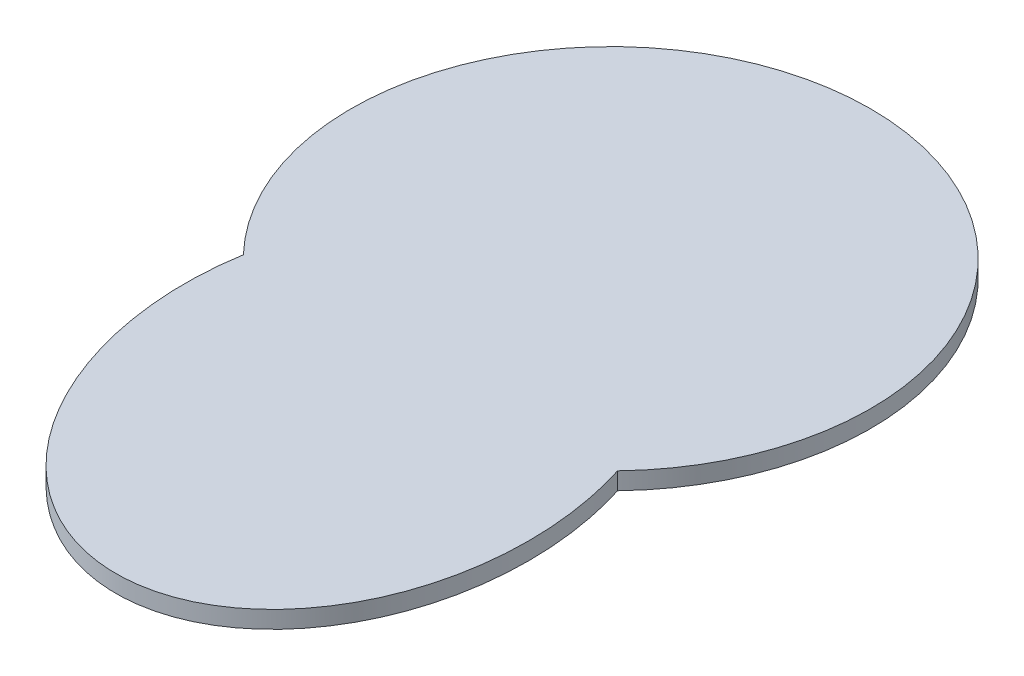
from build123d import *

# Parameters (mm, degrees)
BOSS_EXTRUDE1_DEPTH = 4


with BuildPart() as part:
    # Sketch1 → Boss-Extrude1 (new body)
    with BuildSketch(Plane(origin=(0, 0, 0), x_dir=(1, 0, 0), z_dir=(0, 1, 0))):
        with BuildLine():
            ThreePointArc((41.934392463, 18.394596154), (-1.366877727, 120.240673842), (-44.668147916, 18.394596154))
            add(Edge.make_bspline(
                [(-44.668147916, 18.394596154), (-57.852745086, -60.252747888), (4.477300744, -60.252747888), (66.807346575, -60.252747888), (41.934392463, 18.394596154)],
                knots=[4.276241532, 4.276241532, 4.276241532, 6.157281417, 6.157281417, 8.038321303, 8.038321303, 8.038321303], degree=2, weights=[1, 0.589368061, 1, 0.589368061, 1]))
        make_face()
    extrude(amount=-BOSS_EXTRUDE1_DEPTH)


solid = part.part
